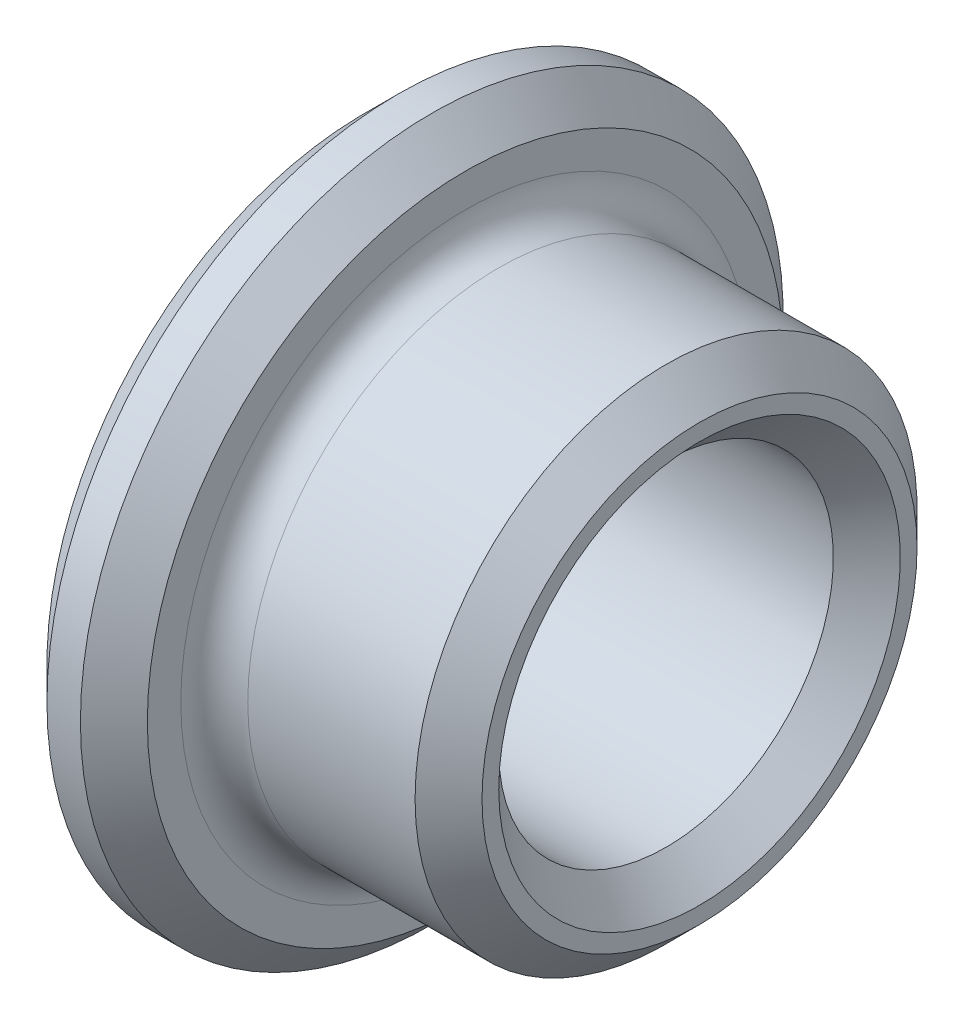
from build123d import *

# Parameters (mm, degrees)
CHAMFER1_SIZE = 1
FILLET1_R     = 1


with BuildPart() as part:
    # Sketch1 → Revolve1 (revolve)
    with BuildSketch(Plane.XY, mode=Mode.PRIVATE) as revolve1_sk:
        Polygon((0, 5), (10, 5), (10, 7.5), (3, 7.5), (3, 10.5), (0, 10.5), align=None)
    revolve(revolve1_sk.sketch.rotate(Axis((0, 0, 0), (1, 0, 0)), 90), axis=Axis((0, 0, 0), (1, 0, 0)))

    # Chamfer1
    chamfer1_edges = [part.edges().sort_by_distance(p)[0] for p in [
        (0, 0, -10.5),
        (3, 0, -10.5),
        (10, 0, -7.5),
        (10, 0, -5),
        (0, 0, -5),
    ]]
    chamfer(chamfer1_edges, length=CHAMFER1_SIZE)

    # Fillet1
    fillet1_edges = [part.edges().sort_by_distance(p)[0] for p in [
        (3, 0, -7.5),
    ]]
    fillet(fillet1_edges, radius=FILLET1_R)


solid = part.part
